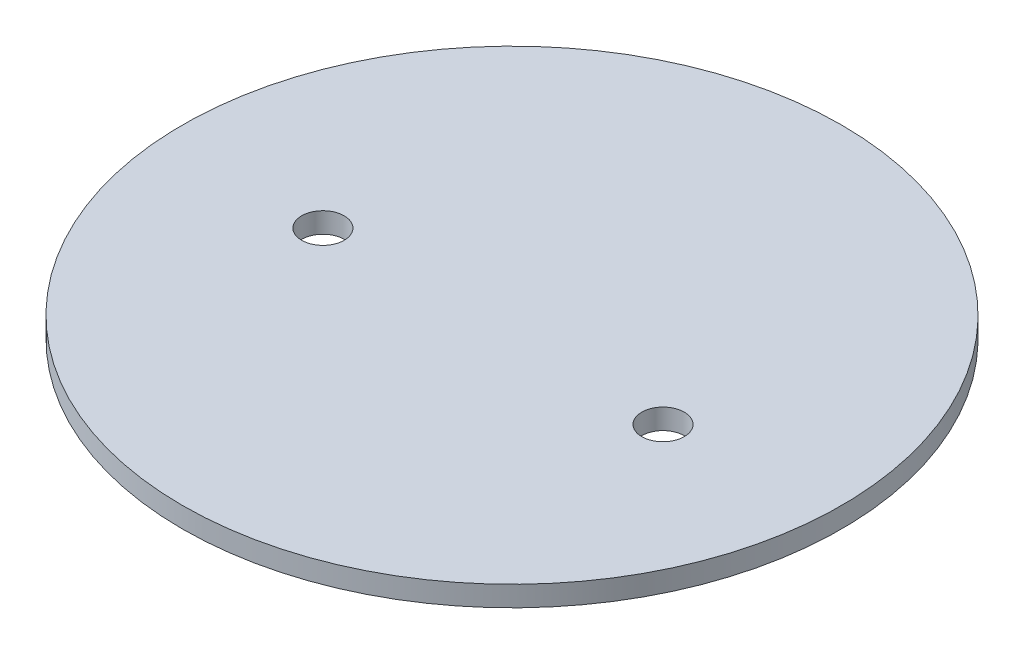
from build123d import *

# Parameters (mm, degrees)
SKETCH1_R           = 96.9
SKETCH1_R_2         = 6.25
BOSS_EXTRUDE1_DEPTH = 3


with BuildPart() as part:
    # Sketch1 → Boss-Extrude1 (new, symmetric)
    with BuildSketch(Plane(origin=(0, 0, 0), x_dir=(1, 0, 0), z_dir=(0, 1, 0))):
        with Locations(Location((0, 0, 0), (0, 0, 270))):
            Circle(SKETCH1_R)
        with Locations(Location((-50, -5.6, 0), (0, 0, 270))):
            Circle(SKETCH1_R_2, mode=Mode.SUBTRACT)
        with Locations(Location((50, -5.6, 0), (0, 0, 270))):
            Circle(SKETCH1_R_2, mode=Mode.SUBTRACT)
    extrude(amount=BOSS_EXTRUDE1_DEPTH, both=True)


solid = part.part
